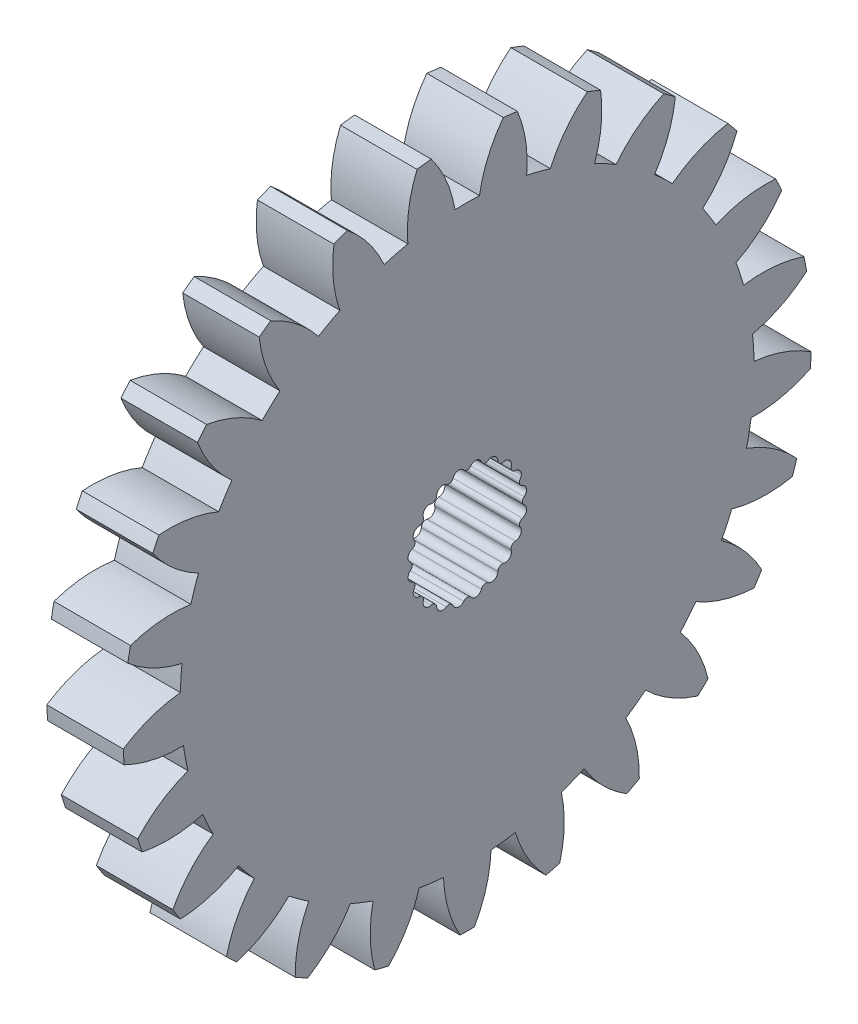
from build123d import *

# Parameters (mm, degrees)
BASPROSKE_W             = 3
BASPROSKE_H             = 13.5
TOOTHCUT_DEPTH          = 20.32614809
TEETHCUTS_COUNT         = 25
TEETHCUTS_ANGLE         = 345.6
CUT_EXTRUDE1_DEPTH      = 20.317784429
CUT_EXTRUDE1_DEPTH_BACK = 20.317784429


with BuildPart() as part:
    # BasProSke → Base-Revolve (revolve)
    with BuildSketch(Plane(origin=(0, 0, 0), x_dir=(1, 0, 0), z_dir=(0, 1, 0)), mode=Mode.PRIVATE) as base_revolve_sk:
        with Locations((1.5, 6.75)):
            Rectangle(BASPROSKE_W, BASPROSKE_H)
    revolve(base_revolve_sk.sketch.rotate(Axis((-10, 0, 0), (1, 0, 0)), 180), axis=Axis((-10, 0, 0), (1, 0, 0)))

    # TooCutSke → ToothCut (cut, through all)
    with BuildSketch(Plane(origin=(0, 0, 0), x_dir=(0, 0, -1), z_dir=(1, 0, 0))):
        with BuildLine():
            ThreePointArc((0.480087995, 11.238750665), (0, 11.249), (-0.480087995, 11.238750665))
            ThreePointArc((-0.480087995, 11.238750665), (-0.821124963, 12.40220054), (-1.432168974, 13.449361962))
            ThreePointArc((-1.432168974, 13.449361962), (0, 13.5254), (1.432168974, 13.449361962))
            ThreePointArc((1.432168974, 13.449361962), (0.821124963, 12.40220054), (0.480087995, 11.238750665))
        make_face()
    toothcut = extrude(amount=TOOTHCUT_DEPTH, mode=Mode.SUBTRACT)

    # TeethCuts: ToothCut ×25 about axis
    teethcuts_axis = Axis((-10, 0, 0), (1, 0, 0))
    for i in range(1, TEETHCUTS_COUNT):
        add(toothcut.rotate(teethcuts_axis, i * TEETHCUTS_ANGLE / (TEETHCUTS_COUNT - 1)), mode=Mode.SUBTRACT)

    # Sketch1 → Cut-Extrude1 (cut, two sides: drawn at the far end of the back side and taken through both)
    with BuildSketch(Plane(origin=(3, 0, 0), x_dir=(0, 0, -1), z_dir=(1, 0, 0)).offset(-CUT_EXTRUDE1_DEPTH_BACK)):
        with BuildLine():
            ThreePointArc((1.661700936, 1.661700936), (1.550665116, 1.724852302), (1.42295102, 1.722370773))
            ThreePointArc((1.42295102, 1.722370773), (1.34363469, 1.717709724), (1.270432241, 1.748599968))
            ThreePointArc((1.270432241, 1.748599968), (1.218433073, 1.808674024), (1.1983559, 1.88554868))
            ThreePointArc((1.1983559, 1.88554868), (1.161250148, 2.007778837), (1.066877674, 2.093865332))
            ThreePointArc((1.066877674, 2.093865332), (0.941761489, 2.119613895), (0.821065001, 2.077787995))
            ThreePointArc((0.821065001, 2.077787995), (0.747071031, 2.04884498), (0.667905755, 2.055602547))
            ThreePointArc((0.667905755, 2.055602547), (0.599887703, 2.096667742), (0.557037602, 2.163575697))
            ThreePointArc((0.557037602, 2.163575697), (0.483976738, 2.268357177), (0.367620993, 2.3210676))
            ThreePointArc((0.367620993, 2.3210676), (0.240671686, 2.306892912), (0.138807418, 2.229816851))
            ThreePointArc((0.138807418, 2.229816851), (0.077378855, 2.179425013), (0, 2.161388426))
            ThreePointArc((0, 2.161388426), (-0.077378855, 2.179425013), (-0.138807418, 2.229816851))
            ThreePointArc((-0.138807418, 2.229816851), (-0.240671686, 2.306892912), (-0.367620993, 2.3210676))
            ThreePointArc((-0.367620993, 2.3210676), (-0.483976739, 2.268357177), (-0.557037602, 2.163575697))
            ThreePointArc((-0.557037602, 2.163575697), (-0.599887703, 2.096667742), (-0.667905755, 2.055602547))
            ThreePointArc((-0.667905755, 2.055602547), (-0.747071031, 2.04884498), (-0.821065001, 2.077787995))
            ThreePointArc((-0.821065001, 2.077787995), (-0.941761489, 2.119613895), (-1.066877674, 2.093865332))
            ThreePointArc((-1.066877674, 2.093865332), (-1.161250148, 2.007778837), (-1.1983559, 1.88554868))
            ThreePointArc((-1.1983559, 1.88554868), (-1.218433073, 1.808674024), (-1.270432241, 1.748599968))
            ThreePointArc((-1.270432241, 1.748599968), (-1.34363469, 1.717709724), (-1.42295102, 1.722370773))
            ThreePointArc((-1.42295102, 1.722370773), (-1.550665116, 1.724852302), (-1.661700936, 1.661700936))
            ThreePointArc((-1.661700936, 1.661700936), (-1.724852302, 1.550665116), (-1.722370773, 1.42295102))
            ThreePointArc((-1.722370773, 1.42295102), (-1.717709724, 1.34363469), (-1.748599968, 1.270432241))
            ThreePointArc((-1.748599968, 1.270432241), (-1.808674024, 1.218433073), (-1.88554868, 1.1983559))
            ThreePointArc((-1.88554868, 1.1983559), (-2.007778837, 1.161250148), (-2.093865332, 1.066877674))
            ThreePointArc((-2.093865332, 1.066877674), (-2.119613895, 0.941761489), (-2.077787995, 0.821065001))
            ThreePointArc((-2.077787995, 0.821065001), (-2.04884498, 0.747071031), (-2.055602547, 0.667905755))
            ThreePointArc((-2.055602547, 0.667905755), (-2.096667742, 0.599887703), (-2.163575697, 0.557037602))
            ThreePointArc((-2.163575697, 0.557037602), (-2.268357177, 0.483976738), (-2.3210676, 0.367620993))
            ThreePointArc((-2.3210676, 0.367620993), (-2.306892912, 0.240671686), (-2.229816851, 0.138807418))
            ThreePointArc((-2.229816851, 0.138807418), (-2.179425013, 0.077378855), (-2.161388426, 0))
            ThreePointArc((-2.161388426, 0), (-2.179425013, -0.077378855), (-2.229816851, -0.138807418))
            ThreePointArc((-2.229816851, -0.138807418), (-2.306892912, -0.240671686), (-2.3210676, -0.367620993))
            ThreePointArc((-2.3210676, -0.367620993), (-2.268357177, -0.483976738), (-2.163575697, -0.557037602))
            ThreePointArc((-2.163575697, -0.557037602), (-2.096667742, -0.599887703), (-2.055602547, -0.667905755))
            ThreePointArc((-2.055602547, -0.667905755), (-2.04884498, -0.747071031), (-2.077787995, -0.821065001))
            ThreePointArc((-2.077787995, -0.821065001), (-2.119613895, -0.941761489), (-2.093865332, -1.066877674))
            ThreePointArc((-2.093865332, -1.066877674), (-2.076278118, -1.096082269), (-2.054745263, -1.122512453))
            ThreePointArc((-2.054745263, -1.122512453), (-1.977734389, -1.177360691), (-1.88554868, -1.1983559))
            ThreePointArc((-1.88554868, -1.1983559), (-1.808674024, -1.218433073), (-1.748599968, -1.270432241))
            ThreePointArc((-1.748599968, -1.270432241), (-1.717709724, -1.34363469), (-1.722370773, -1.42295102))
            ThreePointArc((-1.722370773, -1.42295102), (-1.724852302, -1.550665116), (-1.661700936, -1.661700936))
            ThreePointArc((-1.661700936, -1.661700936), (-1.550665116, -1.724852302), (-1.42295102, -1.722370773))
            ThreePointArc((-1.42295102, -1.722370773), (-1.34363469, -1.717709724), (-1.270432241, -1.748599968))
            ThreePointArc((-1.270432241, -1.748599968), (-1.218433073, -1.808674023), (-1.1983559, -1.88554868))
            ThreePointArc((-1.1983559, -1.88554868), (-1.161250148, -2.007778837), (-1.066877674, -2.093865332))
            ThreePointArc((-1.066877674, -2.093865332), (-0.941761489, -2.119613895), (-0.821065001, -2.077787995))
            ThreePointArc((-0.821065001, -2.077787995), (-0.747071031, -2.04884498), (-0.667905755, -2.055602547))
            ThreePointArc((-0.667905755, -2.055602547), (-0.599887703, -2.096667742), (-0.557037602, -2.163575697))
            ThreePointArc((-0.557037602, -2.163575697), (-0.483976738, -2.268357177), (-0.367620993, -2.3210676))
            ThreePointArc((-0.367620993, -2.3210676), (-0.240671686, -2.306892911), (-0.138807418, -2.22981685))
            ThreePointArc((-0.138807418, -2.22981685), (-0.077378855, -2.179425013), (0, -2.161388426))
            ThreePointArc((0, -2.161388426), (0.077378855, -2.179425013), (0.138807418, -2.22981685))
            ThreePointArc((0.138807418, -2.22981685), (0.240671686, -2.306892911), (0.367620993, -2.3210676))
            ThreePointArc((0.367620993, -2.3210676), (0.483976738, -2.268357177), (0.557037602, -2.163575697))
            ThreePointArc((0.557037602, -2.163575697), (0.599887703, -2.096667742), (0.667905755, -2.055602547))
            ThreePointArc((0.667905755, -2.055602547), (0.747071031, -2.04884498), (0.821065001, -2.077787995))
            ThreePointArc((0.821065001, -2.077787995), (0.941761489, -2.119613895), (1.066877674, -2.093865332))
            ThreePointArc((1.066877674, -2.093865332), (1.161250148, -2.007778837), (1.1983559, -1.88554868))
            ThreePointArc((1.1983559, -1.88554868), (1.218433073, -1.808674023), (1.270432241, -1.748599968))
            ThreePointArc((1.270432241, -1.748599968), (1.34363469, -1.717709724), (1.42295102, -1.722370773))
            ThreePointArc((1.42295102, -1.722370773), (1.550665116, -1.724852302), (1.661700936, -1.661700936))
            ThreePointArc((1.661700936, -1.661700936), (1.724852302, -1.550665116), (1.722370773, -1.42295102))
            ThreePointArc((1.722370773, -1.42295102), (1.717709724, -1.34363469), (1.748599968, -1.270432241))
            ThreePointArc((1.748599968, -1.270432241), (1.808674023, -1.218433073), (1.88554868, -1.1983559))
            ThreePointArc((1.88554868, -1.1983559), (2.007778837, -1.161250148), (2.093865332, -1.066877674))
            ThreePointArc((2.093865332, -1.066877674), (2.119613895, -0.941761489), (2.077787995, -0.821065001))
            ThreePointArc((2.077787995, -0.821065001), (2.04884498, -0.747071031), (2.055602547, -0.667905755))
            ThreePointArc((2.055602547, -0.667905755), (2.096667742, -0.599887703), (2.163575697, -0.557037601))
            ThreePointArc((2.163575697, -0.557037601), (2.268357177, -0.483976738), (2.3210676, -0.367620993))
            ThreePointArc((2.3210676, -0.367620993), (2.306892912, -0.240671686), (2.229816851, -0.138807418))
            ThreePointArc((2.229816851, -0.138807418), (2.179425014, -0.077378855), (2.161388426, 0))
            ThreePointArc((2.161388426, 0), (2.179425014, 0.077378855), (2.229816851, 0.138807418))
            ThreePointArc((2.229816851, 0.138807418), (2.306892912, 0.240671686), (2.3210676, 0.367620993))
            ThreePointArc((2.3210676, 0.367620993), (2.268357177, 0.483976738), (2.163575697, 0.557037602))
            ThreePointArc((2.163575697, 0.557037602), (2.096667742, 0.599887703), (2.055602547, 0.667905755))
            ThreePointArc((2.055602547, 0.667905755), (2.04884498, 0.747071031), (2.077787995, 0.821065001))
            ThreePointArc((2.077787995, 0.821065001), (2.119613895, 0.941761489), (2.093865332, 1.066877674))
            ThreePointArc((2.093865332, 1.066877674), (2.076278118, 1.09608227), (2.054745263, 1.122512453))
            ThreePointArc((2.054745263, 1.122512453), (1.977734389, 1.177360691), (1.88554868, 1.1983559))
            ThreePointArc((1.88554868, 1.1983559), (1.808674023, 1.218433073), (1.748599968, 1.270432241))
            ThreePointArc((1.748599968, 1.270432241), (1.717709724, 1.34363469), (1.722370773, 1.42295102))
            ThreePointArc((1.722370773, 1.42295102), (1.724852302, 1.550665116), (1.661700936, 1.661700936))
        make_face()
    extrude(amount=CUT_EXTRUDE1_DEPTH + CUT_EXTRUDE1_DEPTH_BACK, mode=Mode.SUBTRACT)


solid = part.part
